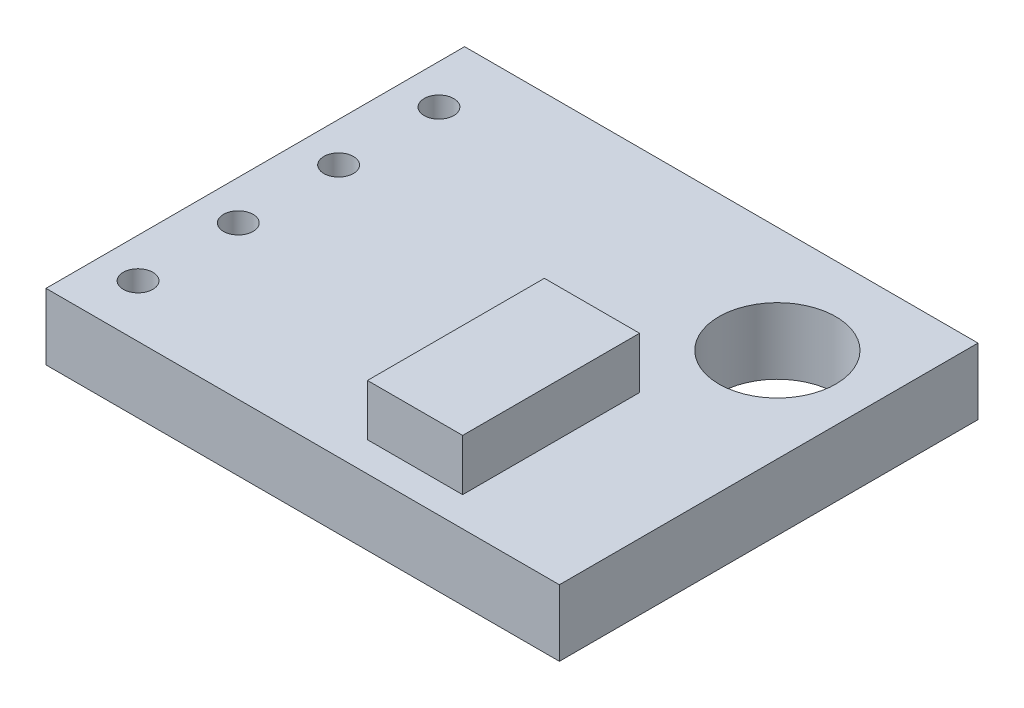
from build123d import *

# Parameters (mm, degrees)
CROQUIS1_W              = 13
CROQUIS1_H              = 10.6
SALIENTE_EXTRUIR1_DEPTH = 1.68
CROQUIS2_W              = 2.41
CROQUIS2_H              = 4.48
SALIENTE_EXTRUIR2_DEPTH = 1.3
CROQUIS3_R              = 1.48
CORTAR_EXTRUIR1_DEPTH   = 9.553502207
CROQUIS4_R              = 0.375
CORTAR_EXTRUIR2_DEPTH   = 9.553502207


with BuildPart() as part:
    # Croquis1 → Saliente-Extruir1 (new body)
    with BuildSketch(Plane(origin=(0, 0, 0), x_dir=(1, 0, 0), z_dir=(0, 1, 0))):
        Rectangle(CROQUIS1_W, CROQUIS1_H)
    extrude(amount=SALIENTE_EXTRUIR1_DEPTH)

    # Croquis2 → Saliente-Extruir2 (add)
    with BuildSketch(Plane(origin=(0, 1.68, 0), x_dir=(1, 0, 0), z_dir=(0, 1, 0))):
        with Locations((2.095, -2.31)):
            Rectangle(CROQUIS2_W, CROQUIS2_H)
    extrude(amount=SALIENTE_EXTRUIR2_DEPTH)

    # Croquis3 → Cortar-Extruir1 (cut, through all)
    with BuildSketch(Plane(origin=(0, 1.68, 0), x_dir=(1, 0, 0), z_dir=(0, 1, 0))):
        with Locations(Location((4.12, 2.6, 0), (0, 0, 270))):
            Circle(CROQUIS3_R)
    extrude(amount=-CORTAR_EXTRUIR1_DEPTH, mode=Mode.SUBTRACT)

    # Croquis4 → Cortar-Extruir2 (cut, through all)
    with BuildSketch(Plane(origin=(0, 1.68, 0), x_dir=(1, 0, 0), z_dir=(0, 1, 0))):
        with Locations(Location((-5.5, 3.65, 0), (0, 0, 270))):
            Circle(CROQUIS4_R)
        with Locations(Location((-5.5, 1.11, 0), (0, 0, 270))):
            Circle(CROQUIS4_R)
        with Locations(Location((-5.5, -1.43, 0), (0, 0, 270))):
            Circle(CROQUIS4_R)
        with Locations(Location((-5.5, -3.97, 0), (0, 0, 270))):
            Circle(CROQUIS4_R)
    extrude(amount=-CORTAR_EXTRUIR2_DEPTH, mode=Mode.SUBTRACT)


solid = part.part
